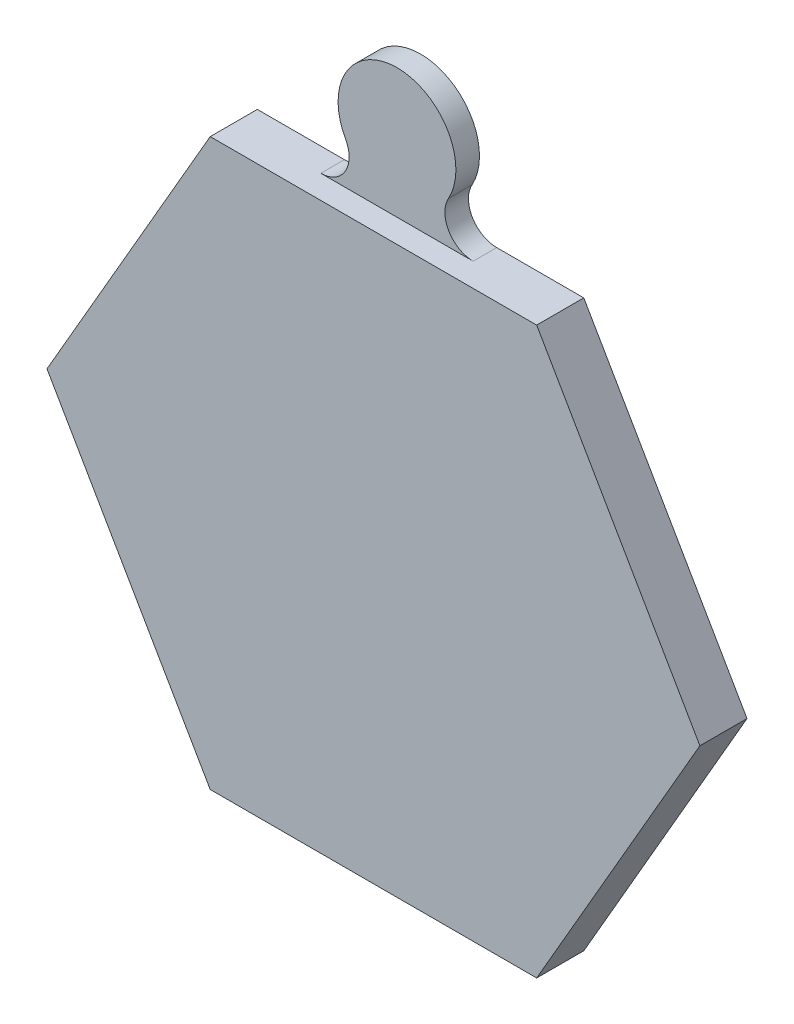
from build123d import *

# Parameters (mm, degrees)
EXTRUDE_1_DEPTH     = 10
EXTRUDE_2_DEPTH     = 5
CUT_EXTRUDE_2_DEPTH = 5


with BuildPart() as part:
    # 草图1 → 凸台-拉伸1 (new body)
    with BuildSketch(Plane.XY):
        Polygon((69.282032303, 0), (34.641016151, 60), (-34.641016151, 60), (-69.282032303, 0), (-34.641016151, -60), (34.641016151, -60), align=None)
    extrude(amount=EXTRUDE_1_DEPTH)

    # 草图2 → 凸台-拉伸2 (add)
    with BuildSketch(Plane(origin=(0, 0, 0), x_dir=(-1, 0, 0), z_dir=(0, 0, -1))):
        with BuildLine():
            Line((-16.163229875, 60), (16.163229875, 60))
            ThreePointArc((16.163229875, 60), (10.9905365, 62.959729742), (10.921101267, 68.918918919))
            ThreePointArc((10.921101267, 68.918918919), (0, 87.5), (-10.921101267, 68.918918919))
            ThreePointArc((-10.921101267, 68.918918919), (-10.9905365, 62.959729742), (-16.163229875, 60))
        make_face()
    extrude(amount=-EXTRUDE_2_DEPTH)

    # 草图3 → 切除-拉伸2 (cut)
    with BuildSketch(Plane(origin=(0, 0, 0), x_dir=(-1, 0, 0), z_dir=(0, 0, -1))):
        with BuildLine():
            ThreePointArc((-11.026755844, -51.096774194), (-11.109451344, -57.048003048), (-16.27759196, -60))
            Line((-16.27759196, -60), (0, -60))
            Line((0, -60), (16.27759196, -60))
            ThreePointArc((16.27759196, -60), (11.109451344, -57.048003048), (11.026755844, -51.096774194))
            ThreePointArc((11.026755844, -51.096774194), (0, -32.4), (-11.026755844, -51.096774194))
        make_face()
    extrude(amount=-CUT_EXTRUDE_2_DEPTH, mode=Mode.SUBTRACT)


solid = part.part
